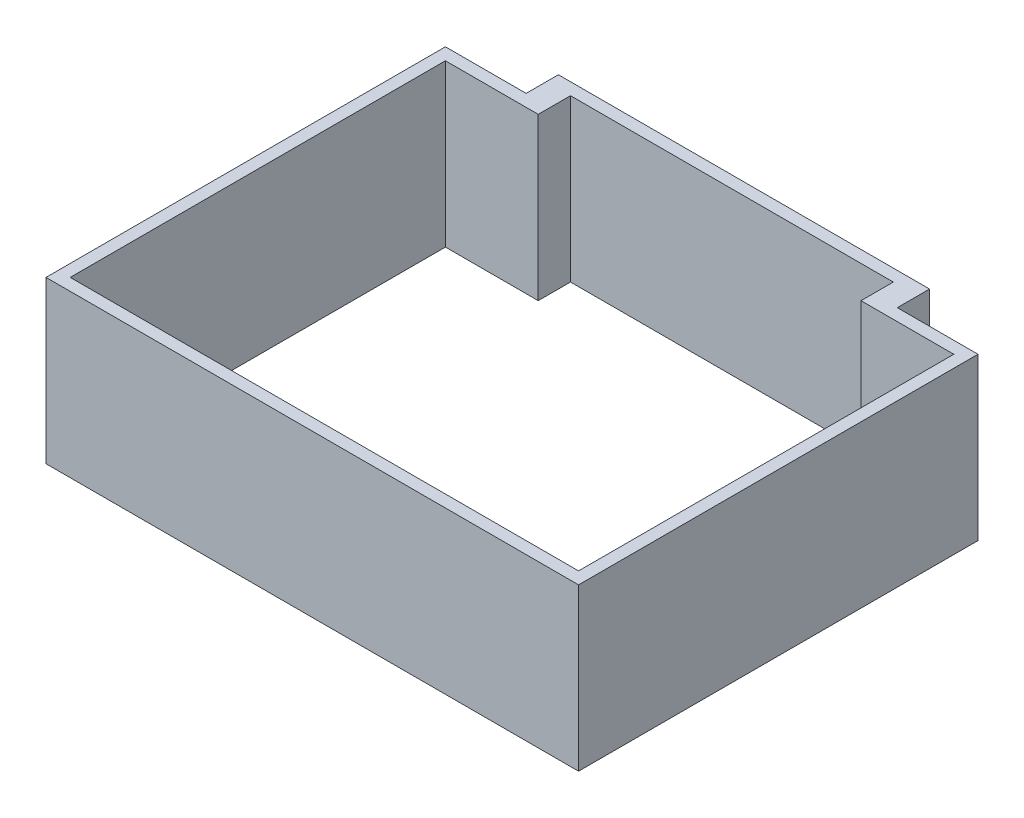
from build123d import *

# Parameters (mm, degrees)
SKETCH_4_W        = 44
SKETCH_4_H        = 20
EXTRUDE_282_DEPTH = 1.5
SKETCH_5_W        = 3
SKETCH_5_H        = 20
EXTRUDE_1_DEPTH   = 5.5
EXTRUDE_START     = 4
SKETCH_6_W        = 12
SKETCH_6_H        = 20
EXTRUDE_1_2_DEPTH = 1.5
SKETCH_7_W        = 1.5
SKETCH_7_H        = 20
EXTRUDE_1_3_DEPTH = 48
SKETCH_8_W        = 3
SKETCH_8_H        = 20
EXTRUDE_1_4_DEPTH = 5.5
SKETCH_9_W        = 12
SKETCH_9_H        = 20
EXTRUDE_1_5_DEPTH = 1.5
SKETCH_10_W       = 1.5
SKETCH_10_H       = 20
EXTRUDE_1_6_DEPTH = 48
EXTRUDE_START_2   = 52
SKETCH_11_W       = 66
SKETCH_11_H       = 20
EXTRUDE_763_DEPTH = 1.5


with BuildPart() as part:
    # 草图4 → Extrude 282 (new body)
    with BuildSketch(Plane.XY):
        Rectangle(SKETCH_4_W, SKETCH_4_H)
    extrude(amount=EXTRUDE_282_DEPTH)

    # 草图5 → Extrude 1 (add)
    with BuildSketch(Plane.XY):
        with Locations((-21.5, 0)):
            Rectangle(SKETCH_5_W, SKETCH_5_H)
    extrude(amount=EXTRUDE_1_DEPTH)

    # 草图6 → Extrude 1 2 (add)
    with BuildSketch(Plane.XY.offset(EXTRUDE_START)):
        with Locations((-27, 0)):
            Rectangle(SKETCH_6_W, SKETCH_6_H)
    extrude(amount=EXTRUDE_1_2_DEPTH)

    # 草图7 → Extrude 1 3 (add)
    with BuildSketch(Plane.XY.offset(EXTRUDE_START)):
        with Locations((-32.25, 0)):
            Rectangle(SKETCH_7_W, SKETCH_7_H)
    extrude(amount=EXTRUDE_1_3_DEPTH)

    # 草图8 → Extrude 1 4 (add)
    with BuildSketch(Plane.XY):
        with Locations((21.5, 0)):
            Rectangle(SKETCH_8_W, SKETCH_8_H)
    extrude(amount=EXTRUDE_1_4_DEPTH)

    # 草图9 → Extrude 1 5 (add)
    with BuildSketch(Plane.XY.offset(EXTRUDE_START)):
        with Locations((27, 0)):
            Rectangle(SKETCH_9_W, SKETCH_9_H)
    extrude(amount=EXTRUDE_1_5_DEPTH)

    # 草图10 → Extrude 1 6 (add)
    with BuildSketch(Plane.XY.offset(EXTRUDE_START)):
        with Locations((32.25, 0)):
            Rectangle(SKETCH_10_W, SKETCH_10_H)
    extrude(amount=EXTRUDE_1_6_DEPTH)

    # 草图11 → Extrude 763 (add)
    with BuildSketch(Plane.XY.offset(EXTRUDE_START_2)):
        Rectangle(SKETCH_11_W, SKETCH_11_H)
    extrude(amount=EXTRUDE_763_DEPTH)


solid = part.part
